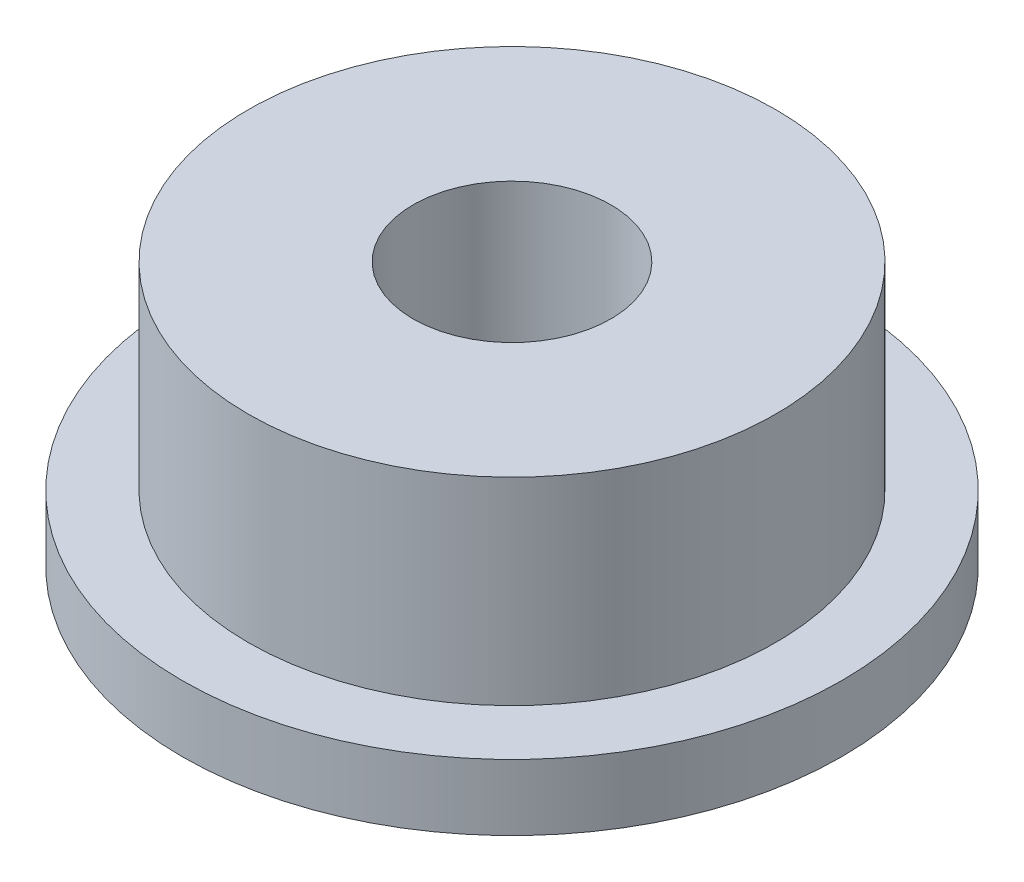
from build123d import *

# Parameters (mm, degrees)
SKETCH_1_R      = 5
SKETCH_1_R_2    = 1.5
EXTRUDE_1_DEPTH = 1
SKETCH_2_R      = 4
SKETCH_2_R_2    = 1.5
EXTRUDE_2_DEPTH = 3


with BuildPart() as part:
    # 草图1 → 凸台-拉伸1 (new body)
    with BuildSketch(Plane(origin=(0, 0, 0), x_dir=(1, 0, 0), z_dir=(0, 1, 0))):
        with Locations(Location((0, 0, 0), (0, 0, 270))):
            Circle(SKETCH_1_R)
        with Locations(Location((0, 0, 0), (0, 0, 270))):
            Circle(SKETCH_1_R_2, mode=Mode.SUBTRACT)
    extrude(amount=EXTRUDE_1_DEPTH)

    # 草图2 → 凸台-拉伸2 (add)
    with BuildSketch(Plane(origin=(0, 1, 0), x_dir=(1, 0, 0), z_dir=(0, 1, 0))):
        with Locations(Location((0, 0, 0), (0, 0, 270))):
            Circle(SKETCH_2_R)
        with Locations(Location((0, 0, 0), (0, 0, 270))):
            Circle(SKETCH_2_R_2, mode=Mode.SUBTRACT)
    extrude(amount=EXTRUDE_2_DEPTH)


solid = part.part
